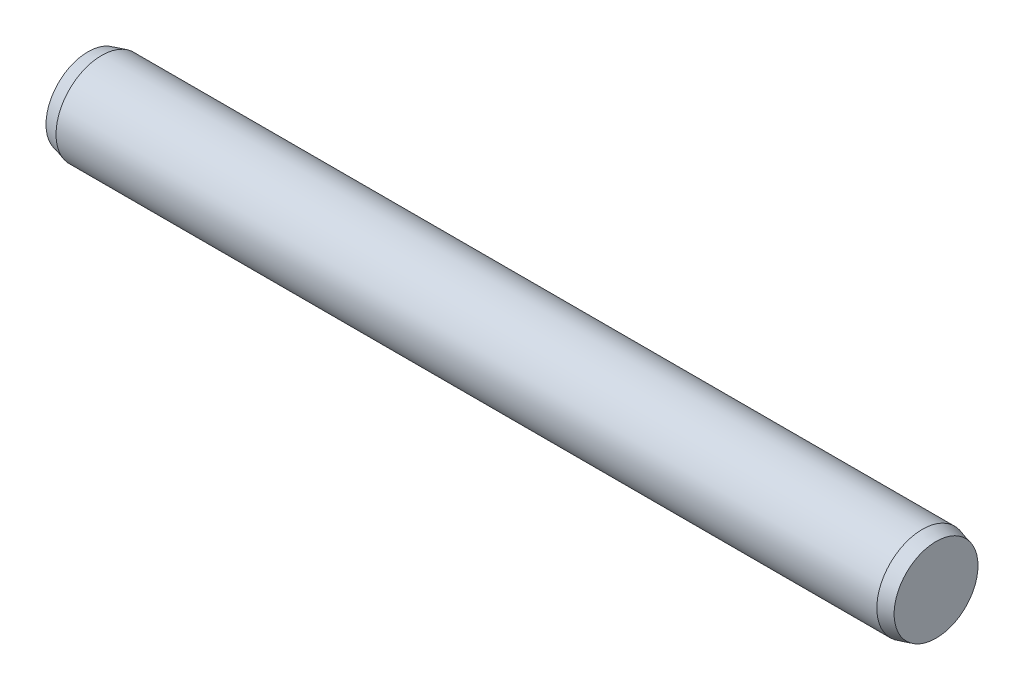
from build123d import *

# Parameters (mm, degrees)
EXTRUDE1_DEPTH      = 9
EXTRUDE1_DEPTH_BACK = 9
SKETCH2_R           = 1
SKETCH3_R           = 1
EXTRUDE2_DEPTH      = 0.3
EXTRUDE2_TAPER      = 15
SKETCH4_R           = 1
EXTRUDE3_DEPTH      = 0.3
EXTRUDE3_TAPER      = 15


with BuildPart() as part:
    # Sketch2 → Extrude1 (new, two sides: drawn at the far end of the back side and taken through both)
    with BuildSketch(Plane(origin=(0, 0, 0), x_dir=(0, 0, -1), z_dir=(1, 0, 0)).offset(-EXTRUDE1_DEPTH_BACK)):
        Circle(SKETCH2_R)
    extrude(amount=EXTRUDE1_DEPTH + EXTRUDE1_DEPTH_BACK)

    # Sketch3 → Extrude2 (add)
    with BuildSketch(Plane(origin=(9, 0, 0), x_dir=(0, 0, -1), z_dir=(1, 0, 0))):
        Circle(SKETCH3_R)
    extrude(amount=EXTRUDE2_DEPTH, taper=EXTRUDE2_TAPER)

    # Sketch4 → Extrude3 (add)
    with BuildSketch(Plane.ZY.offset(9)):
        with Locations(Location((0, 0, 0), (0, 0, 180))):
            Circle(SKETCH4_R)
    extrude(amount=EXTRUDE3_DEPTH, taper=EXTRUDE3_TAPER)


solid = part.part
